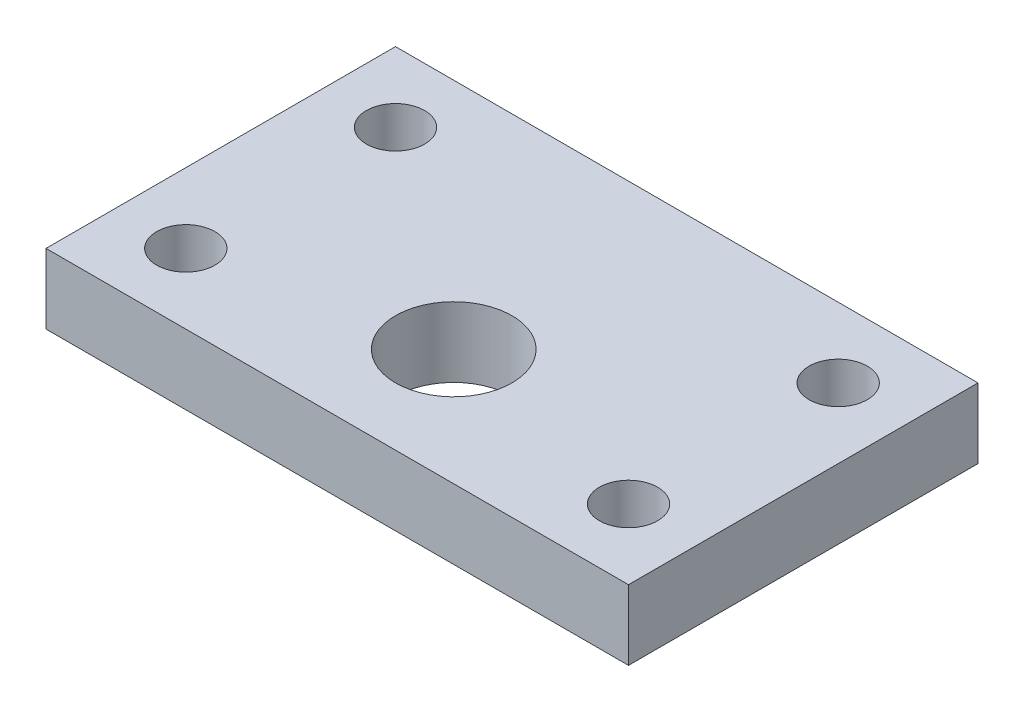
from build123d import *

# Parameters (mm, degrees)
SKETCH1_W           = 250
SKETCH1_H           = 150
SKETCH1_R           = 25
SKETCH1_R_2         = 12.5
BOSS_EXTRUDE1_DEPTH = 30


with BuildPart() as part:
    # Sketch1 → Boss-Extrude1 (new body)
    with BuildSketch(Plane(origin=(0, 0, 0), x_dir=(1, 0, 0), z_dir=(0, 1, 0))):
        Rectangle(SKETCH1_W, SKETCH1_H)
        with Locations(Location((0, -25, 0), (0, 0, 270))):
            Circle(SKETCH1_R, mode=Mode.SUBTRACT)
        with Locations(Location((-95, -45, 0), (0, 0, 270))):
            Circle(SKETCH1_R_2, mode=Mode.SUBTRACT)
        with Locations(Location((-95, 45, 0), (0, 0, 270))):
            Circle(SKETCH1_R_2, mode=Mode.SUBTRACT)
        with Locations(Location((95, 45, 0), (0, 0, 270))):
            Circle(SKETCH1_R_2, mode=Mode.SUBTRACT)
        with Locations(Location((95, -45, 0), (0, 0, 270))):
            Circle(SKETCH1_R_2, mode=Mode.SUBTRACT)
    extrude(amount=BOSS_EXTRUDE1_DEPTH)


solid = part.part
